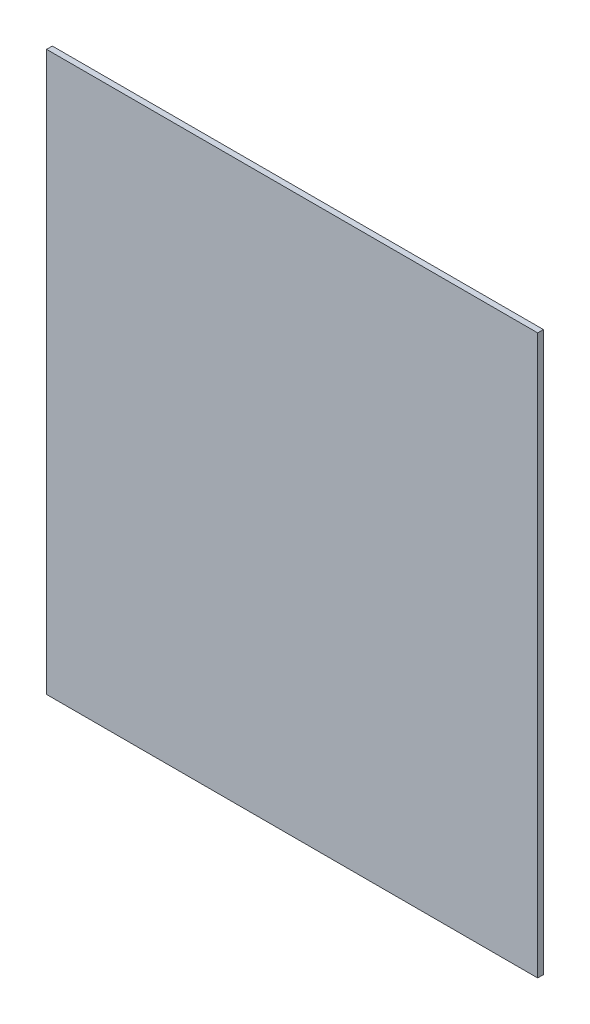
from build123d import *

# Parameters (mm, degrees)
CROQUIS1_W              = 255.9
CROQUIS1_H              = 291.1
SALIENTE_EXTRUIR1_DEPTH = 3


with BuildPart() as part:
    # Croquis1 → Saliente-Extruir1 (new body)
    with BuildSketch(Plane.XY):
        with Locations((-35.598258563, 47.621224832)):
            Rectangle(CROQUIS1_W, CROQUIS1_H)
    extrude(amount=SALIENTE_EXTRUIR1_DEPTH)


solid = part.part
